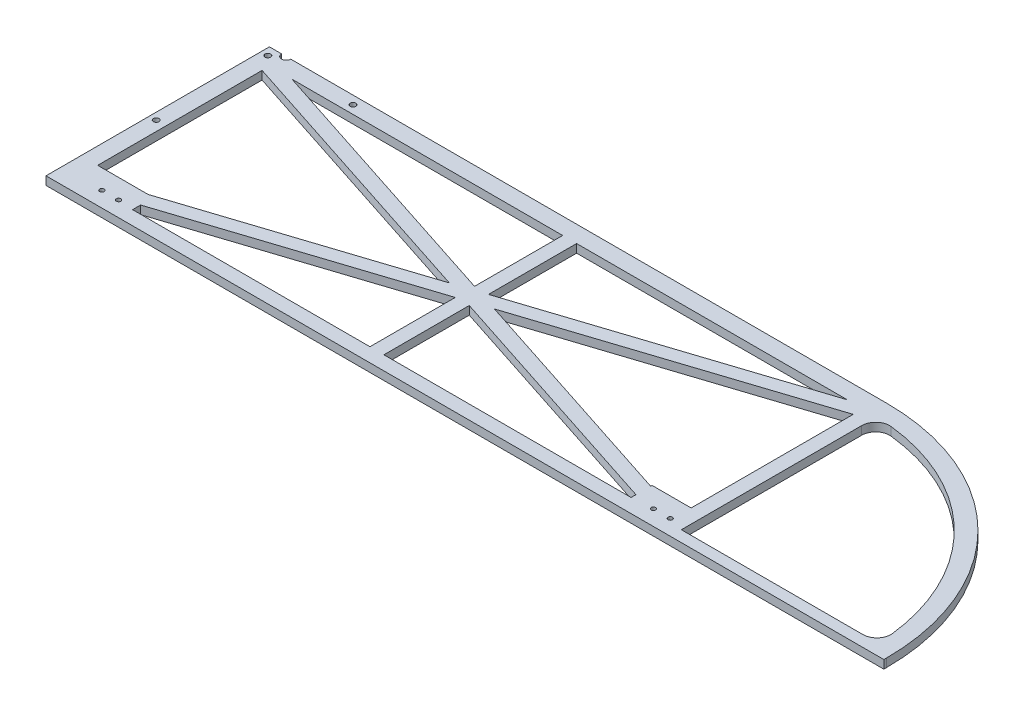
from build123d import *

# Parameters (mm, degrees)
SKETCH_1_R          = 1
EXTRUDE_1_DEPTH     = 3
SKETCH_4_R          = 0.8
SKETCH_4_R_2        = 1.65
CUT_EXTRUDE_2_DEPTH = 18
SKETCH_6_W          = 178.5
SKETCH_6_H          = 1
EXTRUDE_2_DEPTH     = 3


with BuildPart() as part:
    # 草图1 → 凸台-拉伸1 (new body)
    with BuildSketch(Plane(origin=(0, 0, 0), x_dir=(1, 0, 0), z_dir=(0, 1, 0))):
        with BuildLine():
            Line((-150, 40), (71, 40))
            ThreePointArc((71, 40), (126.861435714, 16.861435714), (150, -39))
            Line((150, -39), (150, -40))
            Line((150, -40), (-150, -40))
            Line((-150, -40), (-150, 40))
        make_face()
        with Locations(Location((-117.057778193, 37, 0), (0, 0, 270))):
            Circle(SKETCH_1_R, mode=Mode.SUBTRACT)
        with Locations(Location((-147.557778193, 37, 0), (0, 0, 270))):
            Circle(SKETCH_1_R, mode=Mode.SUBTRACT)
        with Locations(Location((-147.557778193, -3, 0), (0, 0, 270))):
            Circle(SKETCH_1_R, mode=Mode.SUBTRACT)
    extrude(amount=EXTRUDE_1_DEPTH)

    # 草图4 → 切除-拉伸2 (cut)
    with BuildSketch(Plane(origin=(0, 0, 0), x_dir=(1, 0, 0), z_dir=(0, 1, 0))):
        Polygon((-34, 2.44312071), (62.924700675, 34), (-34, 34), align=None)
        Polygon((68.5, -27.5), (68.5, 30.55687929), (-28.424700675, -1), (54.5, -27.998739755), (54.5, -27.5), align=None)
        Polygon((-39, 2.44312071), (-39, 34), (-135.924700675, 34), align=None)
        with Locations(Location((68, -34.5, 0), (0, 0, 270))):
            Circle(SKETCH_4_R)
        Polygon((54.5, -36), (54.5, -33.257074199), (-34, -4.44312071), (-34, -36), align=None)
        Polygon((-125.968156468, -27.5), (-44.575299325, -1), (-144, 31.370832778), (-144, -27.5), align=None)
        Polygon((-39, -36), (-39, -4.44312071), (-124, -32.117539315), (-124, -36), align=None)
        with BuildLine():
            Line((73.5, 28.585131501), (73.5, -36))
            Line((73.5, -36), (138.527772065, -36))
            ThreePointArc((138.527772065, -36), (142.265497073, -34.321055821), (143.493049422, -30.411764706))
            ThreePointArc((143.493049422, -30.411764706), (122.427421924, 12.809461243), (79.051470588, 33.554626464))
            ThreePointArc((79.051470588, 33.554626464), (75.165135156, 32.310541072), (73.5, 28.585131501))
        make_face()
        with Locations(Location((-129.5, -34.5, 0), (0, 0, 270))):
            Circle(SKETCH_4_R)
        with Locations(Location((-135.5, -34.5, 0), (0, 0, 270))):
            Circle(SKETCH_4_R)
        with Locations(Location((62, -34.5, 0), (0, 0, 270))):
            Circle(SKETCH_4_R)
        with Locations((-144, 40)):
            Circle(SKETCH_4_R_2)
    extrude(amount=CUT_EXTRUDE_2_DEPTH, mode=Mode.SUBTRACT)

    # 草图6 → 凸台-拉伸2 (add, through all)
    with BuildSketch(Plane(origin=(0, 3, 0), x_dir=(1, 0, 0), z_dir=(0, 1, 0))):
        with Locations((-34.75, -35.5)):
            Rectangle(SKETCH_6_W, SKETCH_6_H)
    extrude(amount=-EXTRUDE_2_DEPTH)


solid = part.part
